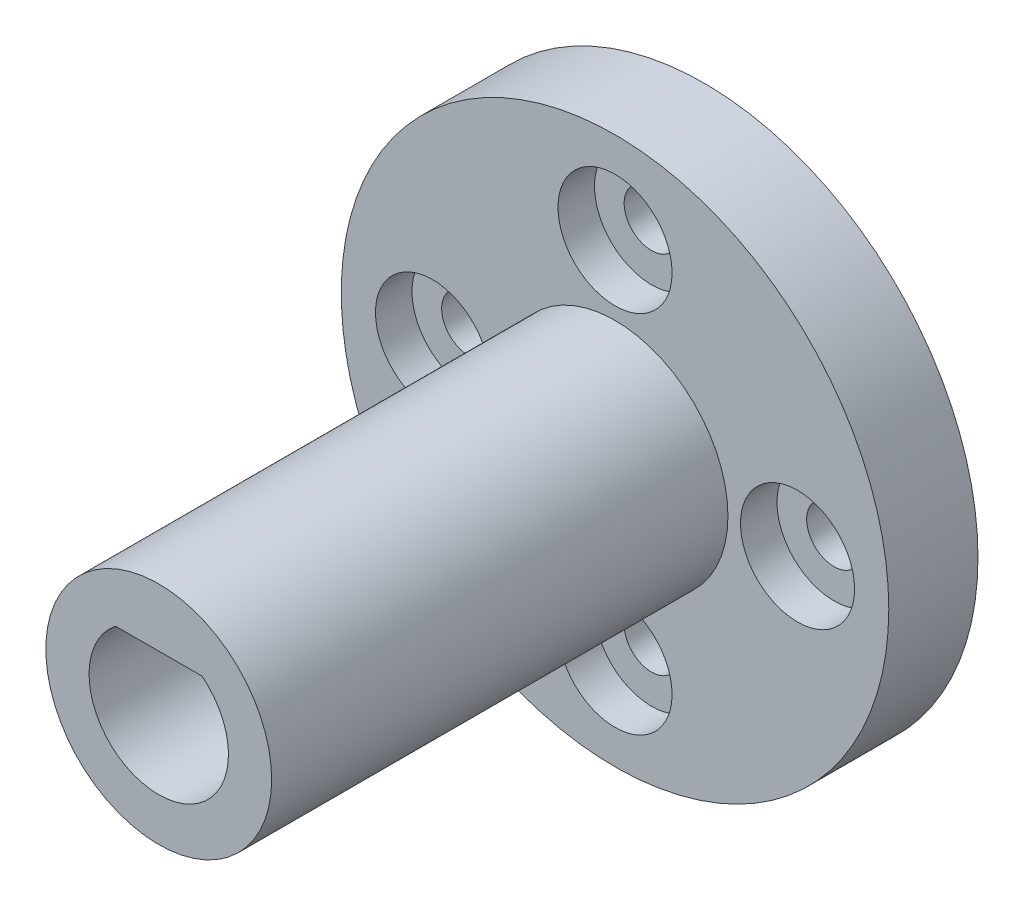
from build123d import *

# Parameters (mm, degrees)
ESQUISSE1_R                                        = 12
BOSS_EXTRU_1_DEPTH                                 = 3.91
ESQUISSE6_R                                        = 4
ENL_V_MAT_EXTRU_2_DEPTH                            = 1.91
ESQUISSE7_R                                        = 4.95
BOSS_EXTRU_2_DEPTH                                 = 20
CHAMBRAGE_POUR_VIS_T_TE_RONDE_BOMB_E_M_D           = 2.4
CHAMBRAGE_POUR_VIS_T_TE_RONDE_BOMB_E_M_CBORE_D     = 5
CHAMBRAGE_POUR_VIS_T_TE_RONDE_BOMB_E_M_CBORE_DEPTH = 1.6
R_P_TITION_CIRCULAIRE2_COUNT                       = 4


with BuildPart() as part:
    # Esquisse1 → Boss.-Extru.1 (new body)
    with BuildSketch(Plane.XY):
        Circle(ESQUISSE1_R)
    extrude(amount=BOSS_EXTRU_1_DEPTH)

    # Esquisse6 → Enlèv. mat.-Extru.2 (cut)
    with BuildSketch(Plane(origin=(0, 0, 0), x_dir=(-1, 0, 0), z_dir=(0, 0, -1))):
        Circle(ESQUISSE6_R)
    extrude(amount=-ENL_V_MAT_EXTRU_2_DEPTH, mode=Mode.SUBTRACT)

    # Esquisse7 → Boss.-Extru.2 (add)
    with BuildSketch(Plane.XY.offset(3.91)):
        Circle(ESQUISSE7_R)
        with BuildLine():
            Line((1.896575862, 2.395), (-1.896575862, 2.395))
            ThreePointArc((-1.896575862, 2.395), (0, -3.055), (1.896575862, 2.395))
        make_face(mode=Mode.SUBTRACT)
    extrude(amount=BOSS_EXTRU_2_DEPTH)

    # Chambrage pour vis à tête ronde bombée M21 (through all)
    with Locations(Plane.XY.offset(3.91)):
        with Locations((0, 8)):
            chambrage_pour_vis_t_te_ronde_bomb_e_m = CounterBoreHole(CHAMBRAGE_POUR_VIS_T_TE_RONDE_BOMB_E_M_D / 2, CHAMBRAGE_POUR_VIS_T_TE_RONDE_BOMB_E_M_CBORE_D / 2, CHAMBRAGE_POUR_VIS_T_TE_RONDE_BOMB_E_M_CBORE_DEPTH)

    # Répétition circulaire2: Chambrage pour vis à tête ronde bombée M21 ×4 about axis
    r_p_tition_circulaire2_axis = Axis((0, 0, 0), (0, 0, 1))
    for i in range(1, R_P_TITION_CIRCULAIRE2_COUNT):
        add(chambrage_pour_vis_t_te_ronde_bomb_e_m.rotate(r_p_tition_circulaire2_axis, i * 360 / R_P_TITION_CIRCULAIRE2_COUNT), mode=Mode.SUBTRACT)


solid = part.part
